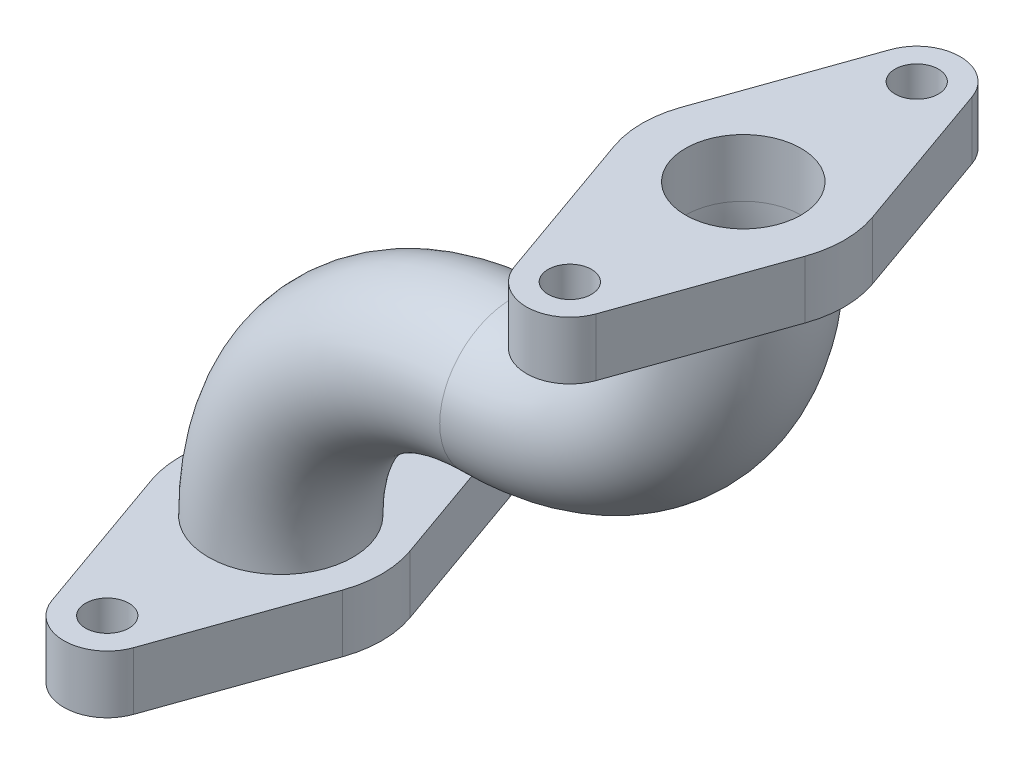
from build123d import *

# Parameters (mm, degrees)
SKETCH1_R               = 4.7625
SKETCH1_R_2             = 12.7
BOSS_EXTRUDE1_DEPTH     = 12.7
SKETCH2_R               = 4.7625
SKETCH2_R_2             = 12.7
BOSS_EXTRUDE2_DEPTH     = 12.7
SWEEP_THIN1_PROFILE_R   = 15.875
SWEEP_THIN1_PROFILE_R_2 = 12.7
SWEEP_THIN2_PROFILE_R   = 15.875
SWEEP_THIN2_PROFILE_R_2 = 12.7


with BuildPart() as part:
    # Sketch1 → Boss-Extrude1 (new body)
    with BuildSketch(Plane(origin=(0, 0, 0), x_dir=(1, 0, 0), z_dir=(0, 1, 0))):
        with BuildLine():
            ThreePointArc((-8.980256121, -41.275), (0, -47.625), (8.980256121, -41.275))
            Line((8.980256121, -41.275), (20.953930949, -7.408333333))
            ThreePointArc((20.953930949, -7.408333333), (22.225, 0), (20.953930949, 7.408333333))
            Line((20.953930949, 7.408333333), (8.980256121, 41.275))
            ThreePointArc((8.980256121, 41.275), (0, 47.625), (-8.980256121, 41.275))
            Line((-8.980256121, 41.275), (-20.953930949, 7.408333333))
            ThreePointArc((-20.953930949, 7.408333333), (-22.225, 0), (-20.953930949, -7.408333333))
            Line((-20.953930949, -7.408333333), (-8.980256121, -41.275))
        make_face()
        with Locations((0, -38.1)):
            Circle(SKETCH1_R, mode=Mode.SUBTRACT)
        with Locations((0, 38.1)):
            Circle(SKETCH1_R, mode=Mode.SUBTRACT)
        Circle(SKETCH1_R_2, mode=Mode.SUBTRACT)
    extrude(amount=-BOSS_EXTRUDE1_DEPTH)

    # Sweep-Thin1: sweep along a path in Sketch3
    with BuildLine(Plane.XY) as sweep_thin1_path:
        ThreePointArc((0, 0), (14.878975516, 35.921024484), (50.8, 50.8))
    # Sweep-Thin1 profile (on start of the path) → Sweep-Thin1 (sweep)
    with BuildSketch(Plane(origin=(0, 0, 0), x_dir=(1, 0, 0), z_dir=(0, 1, 0))):
        Circle(SWEEP_THIN1_PROFILE_R)
        Circle(SWEEP_THIN1_PROFILE_R_2, mode=Mode.SUBTRACT)
    sweep(path=sweep_thin1_path.line)



with BuildPart() as body_2:
    # Sketch2 → Boss-Extrude2 (new body)
    with BuildSketch(Plane(origin=(0, 101.6, 0), x_dir=(1, 0, 0), z_dir=(0, 1, 0))):
        with BuildLine():
            ThreePointArc((92.619743879, -41.275), (101.6, -47.625), (110.580256121, -41.275))
            Line((110.580256121, -41.275), (122.553930949, -7.408333333))
            ThreePointArc((122.553930949, -7.408333333), (123.825, 0), (122.553930949, 7.408333333))
            Line((122.553930949, 7.408333333), (110.580256121, 41.275))
            ThreePointArc((110.580256121, 41.275), (101.6, 47.625), (92.619743879, 41.275))
            Line((92.619743879, 41.275), (80.646069051, 7.408333333))
            ThreePointArc((80.646069051, 7.408333333), (79.375, 0), (80.646069051, -7.408333333))
            Line((80.646069051, -7.408333333), (92.619743879, -41.275))
        make_face()
        with Locations((101.6, -38.1)):
            Circle(SKETCH2_R, mode=Mode.SUBTRACT)
        with Locations((101.6, 38.1)):
            Circle(SKETCH2_R, mode=Mode.SUBTRACT)
        with Locations((101.6, 0)):
            Circle(SKETCH2_R_2, mode=Mode.SUBTRACT)
    extrude(amount=BOSS_EXTRUDE2_DEPTH)


with BuildPart() as part_1:
    add(part.part)

    add(body_2.part)  # Sweep-Thin2 merges body 2
    # Sweep-Thin2: sweep along a path in Sketch25
    with BuildLine(Plane.XY) as sweep_thin2_path:
        ThreePointArc((101.6, 101.6), (86.721024484, 65.678975516), (50.8, 50.8))
    # Sweep-Thin2 profile (on start of the path) → Sweep-Thin2 (sweep)
    with BuildSketch(Plane(origin=(101.6, 101.6, 0), x_dir=(-1, 0, 0), z_dir=(0, -1, 0))):
        Circle(SWEEP_THIN2_PROFILE_R)
        Circle(SWEEP_THIN2_PROFILE_R_2, mode=Mode.SUBTRACT)
    sweep(path=sweep_thin2_path.line)


solid = part_1.part
